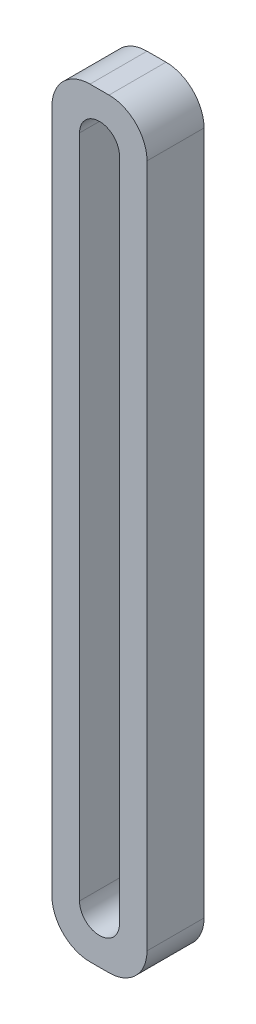
from build123d import *

# Parameters (mm, degrees)
SKETCH1_W           = 5
SKETCH1_H           = 40
BOSS_EXTRUDE1_DEPTH = 3
FILLET1_R           = 2


with BuildPart() as part:
    # Sketch1 → Boss-Extrude1 (new body)
    with BuildSketch(Plane.XY):
        with Locations((2.5, 20)):
            Rectangle(SKETCH1_W, SKETCH1_H)
        with BuildLine():
            Line((3.55, 37.5), (3.55, 2.5))
            ThreePointArc((3.55, 2.5), (2.5, 1.45), (1.45, 2.5))
            Line((1.45, 2.5), (1.45, 37.5))
            ThreePointArc((1.45, 37.5), (2.5, 38.55), (3.55, 37.5))
        make_face(mode=Mode.SUBTRACT)
    extrude(amount=BOSS_EXTRUDE1_DEPTH)

    # Fillet1
    fillet1_edges = [part.edges().sort_by_distance(p)[0] for p in [
        (0, 40, 1.5),
        (5, 40, 1.5),
        (5, 0, 1.5),
        (0, 0, 1.5),
    ]]
    fillet(fillet1_edges, radius=FILLET1_R)


solid = part.part
